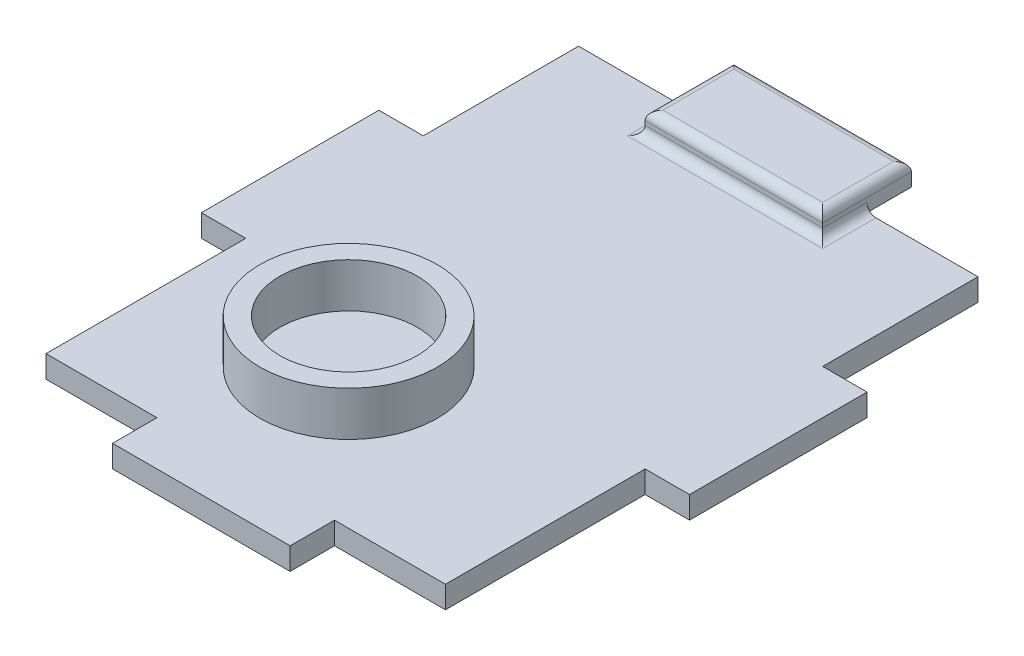
from build123d import *

# Parameters (mm, degrees)
SKETCH1_W           = 90
SKETCH1_H           = 120
SKETCH1_W_2         = 10
SKETCH1_H_2         = 40
SKETCH1_W_3         = 40
SKETCH1_H_3         = 10
BOSS_EXTRUDE1_DEPTH = 5
SKETCH4_R           = 20
SKETCH4_R_2         = 15.5
BOSS_EXTRUDE2_DEPTH = 10
SKETCH5_W           = 40
SKETCH5_H           = 20
BOSS_EXTRUDE3_DEPTH = 5
FILLET1_R           = 2


with BuildPart() as part:
    # Sketch1 → Boss-Extrude1 (new body)
    with BuildSketch(Plane(origin=(0, 0, 0), x_dir=(1, 0, 0), z_dir=(0, 1, 0))):
        with Locations((45, 60)):
            Rectangle(SKETCH1_W, SKETCH1_H)
        with Locations((-5, 65)):
            Rectangle(SKETCH1_W_2, SKETCH1_H_2)
        with Locations((95, 65)):
            Rectangle(SKETCH1_W_2, SKETCH1_H_2)
        with Locations((45, -5)):
            Rectangle(SKETCH1_W_3, SKETCH1_H_3)
    extrude(amount=BOSS_EXTRUDE1_DEPTH)

    # Sketch4 → Boss-Extrude2 (add)
    with BuildSketch(Plane(origin=(0, 5, 0), x_dir=(1, 0, 0), z_dir=(0, 1, 0))):
        with Locations(Location((36.72, 31.47, 0), (0, 0, 270))):
            Circle(SKETCH4_R)
        with Locations(Location((36.72, 31.47, 0), (0, 0, 270))):
            Circle(SKETCH4_R_2, mode=Mode.SUBTRACT)
    extrude(amount=BOSS_EXTRUDE2_DEPTH)

    # Sketch5 → Boss-Extrude3 (add)
    with BuildSketch(Plane(origin=(0, 5, 0), x_dir=(1, 0, 0), z_dir=(0, 1, 0))):
        with Locations((45, 120)):
            Rectangle(SKETCH5_W, SKETCH5_H)
    extrude(amount=BOSS_EXTRUDE3_DEPTH)

    # Fillet1
    fillet1_edges = [part.edges().sort_by_distance(p)[0] for p in [
        (25, 5, -115),
        (45, 5, -110),
        (65, 5, -115),
        (25, 10, -120),
        (45, 10, -110),
        (65, 10, -120),
        (45, 10, -130),
    ]]
    fillet(fillet1_edges, radius=FILLET1_R)


solid = part.part
